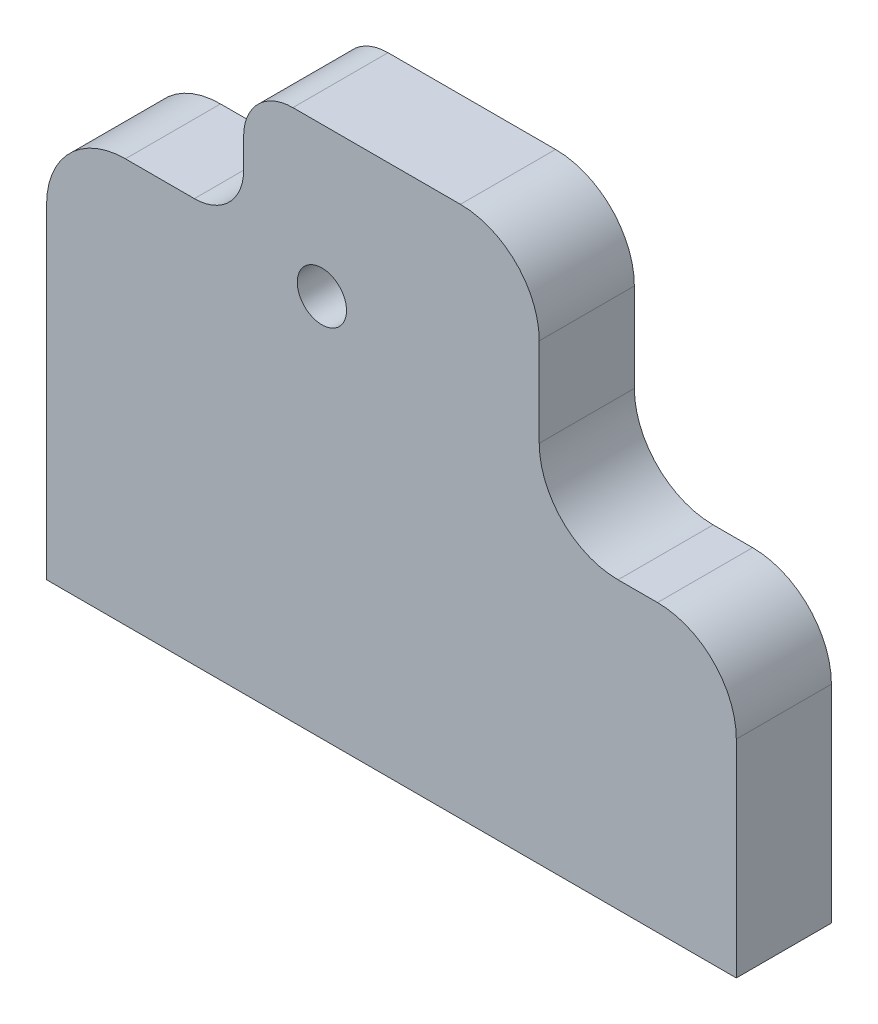
from build123d import *
from build123d.topology import SkipClean

# Parameters (mm, degrees)
BOSS_EXTRUDE1_DEPTH       = 4.826
M3X0_5_TAPPED_HOLE2_D     = 2.5
M3X0_5_TAPPED_HOLE3_D     = 2.5
M3X0_5_TAPPED_HOLE3_DEPTH = 5
M3X0_5_TAPPED_HOLE3_TIP   = 0.751075774
FILLET1_R                 = 2.5
FILLET2_R                 = 4
SKETCH20_W                = 35
SKETCH20_H                = 4.826
SKETCH20_R                = 1.25
BOSS_EXTRUDE2_DEPTH       = 7


with BuildPart() as part:
    # Sketch1 → Boss-Extrude1 (new body)
    with BuildSketch(Plane.XY):
        Polygon((0, 0), (0, 13.5), (10, 13.5), (10, 20), (25, 20), (25, 7.5), (35, 7.5), (35, 0), align=None)
    extrude(amount=BOSS_EXTRUDE1_DEPTH)

    # M3x0.5 Tapped Hole2 (through all)
    with Locations(Plane.XY.offset(4.826)):
        with Locations((13.97024649, 12.44)):
            Hole(M3X0_5_TAPPED_HOLE2_D / 2)

    # M3x0.5 Tapped Hole3
    with Locations(Plane(origin=(0, 0, 0), x_dir=(-1, 0, 0), z_dir=(0, -1, 0))):
        with Locations((-16.73, -2.413), (-28.73, -2.413)):
            Hole(M3X0_5_TAPPED_HOLE3_D / 2, depth=M3X0_5_TAPPED_HOLE3_DEPTH)
            with Locations((0, 0, -(M3X0_5_TAPPED_HOLE3_DEPTH + M3X0_5_TAPPED_HOLE3_TIP / 2))):  # 118° drill point
                Cone(0, M3X0_5_TAPPED_HOLE3_D / 2, M3X0_5_TAPPED_HOLE3_TIP, mode=Mode.SUBTRACT)

    # Fillet1
    fillet1_edges = [part.edges().sort_by_distance(p)[0] for p in [
        (10, 20, 2.413),
        (10, 13.5, 2.413),
    ]]
    fillet(fillet1_edges, radius=FILLET1_R)

    # Fillet2
    fillet2_edges = [part.edges().sort_by_distance(p)[0] for p in [
        (25, 20, 2.413),
        (25, 7.5, 2.413),
        (35, 7.5, 2.413),
        (0, 13.5, 2.413),
    ]]
    fillet(fillet2_edges, radius=FILLET2_R)

    # Sketch20 → Boss-Extrude2 (add)
    with SkipClean():  # the faces are left unmerged after this step: merging them gives an invalid solid
        with BuildSketch(Plane.XZ):
            with Locations((17.5, 2.413)):
                Rectangle(SKETCH20_W, SKETCH20_H)
            with Locations(Location((28.73, 2.413, 0), (0, 0, 270))):
                Circle(SKETCH20_R, mode=Mode.SUBTRACT)
            with Locations(Location((16.73, 2.413, 0), (0, 0, 270))):
                Circle(SKETCH20_R, mode=Mode.SUBTRACT)
        extrude(amount=BOSS_EXTRUDE2_DEPTH)


solid = part.part
